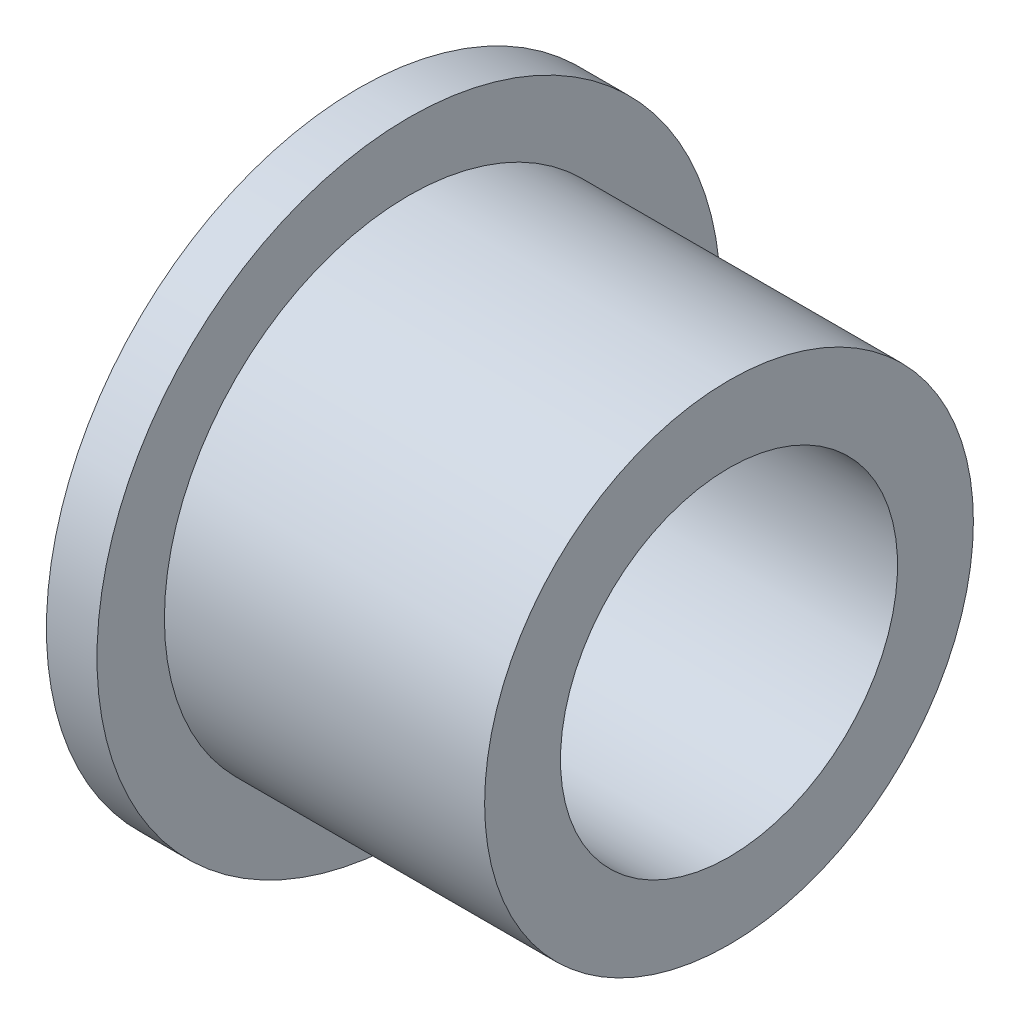
from build123d import *


with BuildPart() as part:
    # Esquisse2 → Base-Révolution (revolve)
    with BuildSketch(Plane.XY, mode=Mode.PRIVATE) as base_r_volution_sk:
        Polygon((0, 10), (0, 18.5), (3, 18.5), (3, 14.5), (22, 14.5), (22, 10), align=None)
    revolve(base_r_volution_sk.sketch.rotate(Axis((0, 0, 0), (1, 0, 0)), 180), axis=Axis((0, 0, 0), (1, 0, 0)))


solid = part.part
